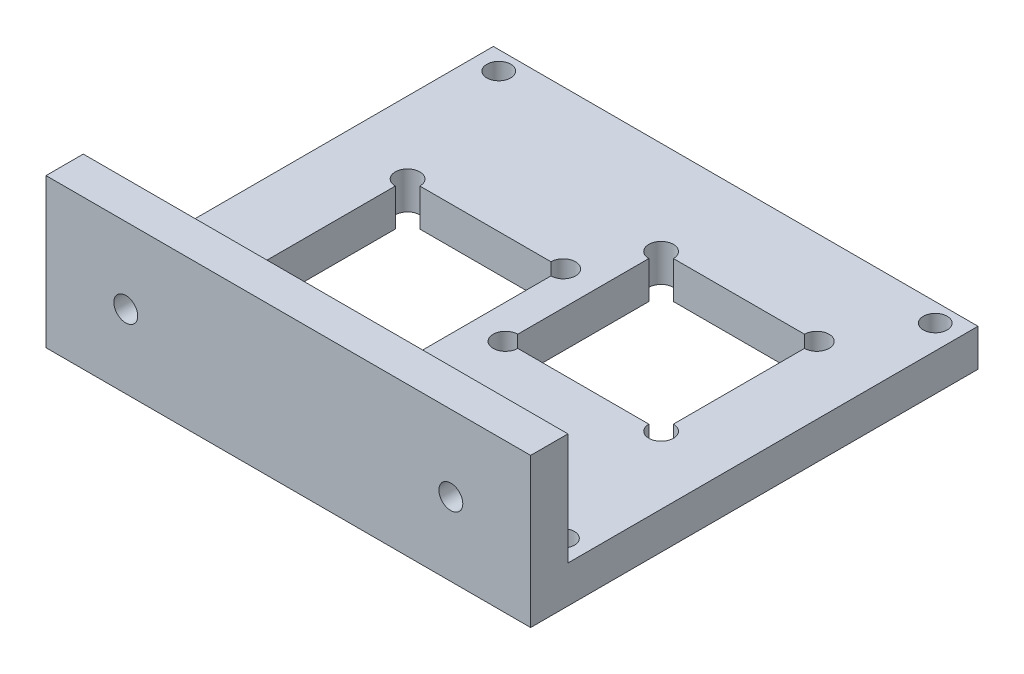
from build123d import *

# Parameters (mm, degrees)
SKETCH_1_R          = 1.6
EXTRUDE_1_DEPTH     = 5
SKETCH_2_R          = 1.65
SKETCH_2_W          = 20.88
SKETCH_2_H          = 20.88
CUT_EXTRUDE_1_DEPTH = 5
SKETCH_4_W          = 65
SKETCH_4_H          = 5
EXTRUDE_2_DEPTH     = 5
SKETCH_5_W          = 65
SKETCH_5_H          = 5
EXTRUDE_3_DEPTH     = 15
SKETCH_6_R          = 1.6
CUT_EXTRUDE_2_DEPTH = 15


with BuildPart() as part:
    # 草图1 → 凸台-拉伸1 (new body)
    with BuildSketch(Plane(origin=(0, 0, 0), x_dir=(1, 0, 0), z_dir=(0, 1, 0))):
        Polygon((-19.989784722, -25.876557595), (32.010215278, -25.876557595), (32.010215278, -30.876557595), (38.510215278, -30.876557595), (38.510215278, 24.123442405), (-26.489784722, 24.123442405), (-26.489784722, -30.876557595), (-19.989784722, -30.876557595), align=None)
        with Locations(Location((-23.259784722, 21.623442405, 0), (0, 0, 270))):
            Circle(SKETCH_1_R, mode=Mode.SUBTRACT)
        with Locations(Location((-23.259784722, -28.376557595, 0), (0, 0, 270))):
            Circle(SKETCH_1_R, mode=Mode.SUBTRACT)
        with Locations(Location((35.280215278, -28.376557595, 0), (0, 0, 270))):
            Circle(SKETCH_1_R, mode=Mode.SUBTRACT)
        with Locations(Location((35.280215278, 21.623442405, 0), (0, 0, 270))):
            Circle(SKETCH_1_R, mode=Mode.SUBTRACT)
    extrude(amount=EXTRUDE_1_DEPTH)

    # 草图2 → 切除-拉伸1 (cut)
    with BuildSketch(Plane(origin=(0, 5, 0), x_dir=(1, 0, 0), z_dir=(0, 1, 0))):
        with BuildLine():
            ThreePointArc((5.678835194, 2.978753935), (4.028835194, 4.628753935), (2.378835194, 2.978753935))
            Line((2.378835194, 2.978753935), (4.028835194, 2.978753935))
            Line((4.028835194, 2.978753935), (4.028835194, 1.328753935))
            ThreePointArc((4.028835194, 1.328753935), (5.195561383, 1.812027746), (5.678835194, 2.978753935))
        make_face()
        with BuildLine():
            Line((4.028835194, 2.978753935), (2.378835194, 2.978753935))
            ThreePointArc((2.378835194, 2.978753935), (2.862109005, 1.812027746), (4.028835194, 1.328753935))
            Line((4.028835194, 1.328753935), (4.028835194, 2.978753935))
        make_face()
        with Locations((-16.851164806, -17.901246065)):
            Circle(SKETCH_2_R)
        with Locations((4.028835194, -17.901246065)):
            Circle(SKETCH_2_R)
        with Locations((4.028835194, 2.978753935)):
            Circle(SKETCH_2_R)
        with Locations((-16.851164806, 2.978753935)):
            Circle(SKETCH_2_R)
        with Locations((-6.411164806, -7.461246065)):
            Rectangle(SKETCH_2_W, SKETCH_2_H)
        with BuildLine():
            ThreePointArc((5.678835194, -17.901246065), (5.195561383, -16.734519876), (4.028835194, -16.251246065))
            Line((4.028835194, -16.251246065), (4.028835194, -17.901246065))
            Line((4.028835194, -17.901246065), (2.378835194, -17.901246065))
            ThreePointArc((2.378835194, -17.901246065), (4.028835194, -19.551246065), (5.678835194, -17.901246065))
        make_face()
        with BuildLine():
            Line((4.028835194, -17.901246065), (4.028835194, -16.251246065))
            ThreePointArc((4.028835194, -16.251246065), (2.862109005, -16.734519876), (2.378835194, -17.901246065))
            Line((2.378835194, -17.901246065), (4.028835194, -17.901246065))
        make_face()
        with BuildLine():
            ThreePointArc((-15.201164806, -17.901246065), (-15.684438617, -16.734519876), (-16.851164806, -16.251246065))
            Line((-16.851164806, -16.251246065), (-16.851164806, -17.901246065))
            Line((-16.851164806, -17.901246065), (-15.201164806, -17.901246065))
        make_face()
        with BuildLine():
            Line((-16.851164806, -17.901246065), (-16.851164806, -16.251246065))
            ThreePointArc((-16.851164806, -16.251246065), (-18.017890995, -19.067972254), (-15.201164806, -17.901246065))
            Line((-15.201164806, -17.901246065), (-16.851164806, -17.901246065))
        make_face()
        with BuildLine():
            ThreePointArc((10.220215278, -9.316557595), (9.736941467, -8.149831407), (8.570215278, -7.666557595))
            Line((8.570215278, -7.666557595), (8.570215278, -9.316557595))
            Line((8.570215278, -9.316557595), (10.220215278, -9.316557595))
        make_face()
        with BuildLine():
            Line((8.570215278, -9.316557595), (8.570215278, -7.666557595))
            ThreePointArc((8.570215278, -7.666557595), (7.403489089, -10.483283784), (10.220215278, -9.316557595))
            Line((10.220215278, -9.316557595), (8.570215278, -9.316557595))
        make_face()
        with Locations((8.570215278, -9.316557595)):
            Circle(SKETCH_2_R)
        with Locations((29.450215278, -9.316557595)):
            Circle(SKETCH_2_R)
        with Locations((29.450215278, 11.563442405)):
            Circle(SKETCH_2_R)
        with Locations((8.570215278, 11.563442405)):
            Circle(SKETCH_2_R)
        with Locations((19.010215278, 1.123442405)):
            Rectangle(SKETCH_2_W, SKETCH_2_H)
        with BuildLine():
            ThreePointArc((31.100215278, 11.563442405), (29.450215278, 13.213442405), (27.800215278, 11.563442405))
            Line((27.800215278, 11.563442405), (29.450215278, 11.563442405))
            Line((29.450215278, 11.563442405), (29.450215278, 9.913442405))
            ThreePointArc((29.450215278, 9.913442405), (30.616941467, 10.396716216), (31.100215278, 11.563442405))
        make_face()
        with BuildLine():
            Line((29.450215278, 11.563442405), (27.800215278, 11.563442405))
            ThreePointArc((27.800215278, 11.563442405), (28.283489089, 10.396716216), (29.450215278, 9.913442405))
            Line((29.450215278, 9.913442405), (29.450215278, 11.563442405))
        make_face()
        with BuildLine():
            ThreePointArc((31.100215278, -9.316557595), (30.616941467, -8.149831407), (29.450215278, -7.666557595))
            Line((29.450215278, -7.666557595), (29.450215278, -9.316557595))
            Line((29.450215278, -9.316557595), (27.800215278, -9.316557595))
            ThreePointArc((27.800215278, -9.316557595), (29.450215278, -10.966557595), (31.100215278, -9.316557595))
        make_face()
        with BuildLine():
            Line((29.450215278, -9.316557595), (29.450215278, -7.666557595))
            ThreePointArc((29.450215278, -7.666557595), (28.283489089, -8.149831407), (27.800215278, -9.316557595))
            Line((27.800215278, -9.316557595), (29.450215278, -9.316557595))
        make_face()
    extrude(amount=-CUT_EXTRUDE_1_DEPTH, mode=Mode.SUBTRACT)

    # 草图4 → 凸台-拉伸2 (add)
    with BuildSketch(Plane.XY.offset(30.876557595)):
        with Locations((6.010215278, 2.5)):
            Rectangle(SKETCH_4_W, SKETCH_4_H)
    extrude(amount=EXTRUDE_2_DEPTH)

    # 草图5 → 凸台-拉伸3 (add)
    with BuildSketch(Plane(origin=(0, 5, 0), x_dir=(1, 0, 0), z_dir=(0, 1, 0))):
        with Locations((6.010215278, -33.376557595)):
            Rectangle(SKETCH_5_W, SKETCH_5_H)
    extrude(amount=EXTRUDE_3_DEPTH)

    # 草图6 → 切除-拉伸2 (cut)
    with BuildSketch(Plane(origin=(0, 0, 30.876557595), x_dir=(-1, 0, 0), z_dir=(0, 0, -1))):
        with Locations((-27.810215278, 9.832763387)):
            Circle(SKETCH_6_R)
        with Locations((15.789784722, 9.832763387)):
            Circle(SKETCH_6_R)
    extrude(amount=-CUT_EXTRUDE_2_DEPTH, mode=Mode.SUBTRACT)


solid = part.part
